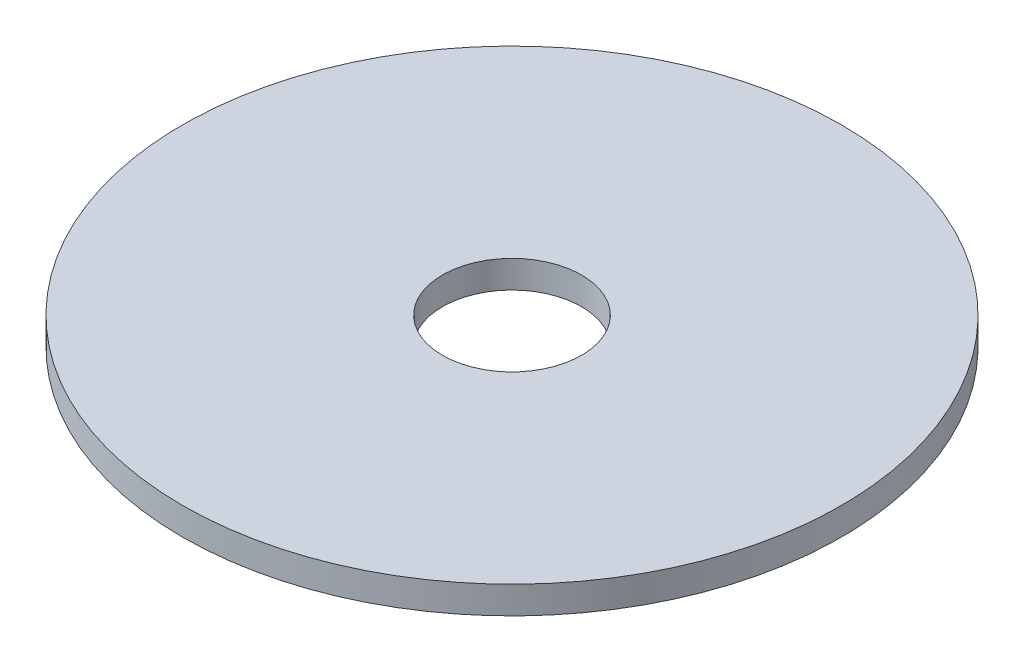
from build123d import *

# Parameters (mm, degrees)
SKETCH_1_R      = 36
SKETCH_1_R_2    = 7.6
EXTRUDE_1_DEPTH = 3


with BuildPart() as part:
    # Эскиз1 → Вытянуть1 (new body)
    with BuildSketch(Plane(origin=(0, 0, 0), x_dir=(1, 0, 0), z_dir=(0, 1, 0))):
        with Locations(Location((0, 0, 0), (0, 0, 270))):
            Circle(SKETCH_1_R)
        with Locations(Location((0, 0, 0), (0, 0, 270))):
            Circle(SKETCH_1_R_2, mode=Mode.SUBTRACT)
    extrude(amount=EXTRUDE_1_DEPTH)


solid = part.part
